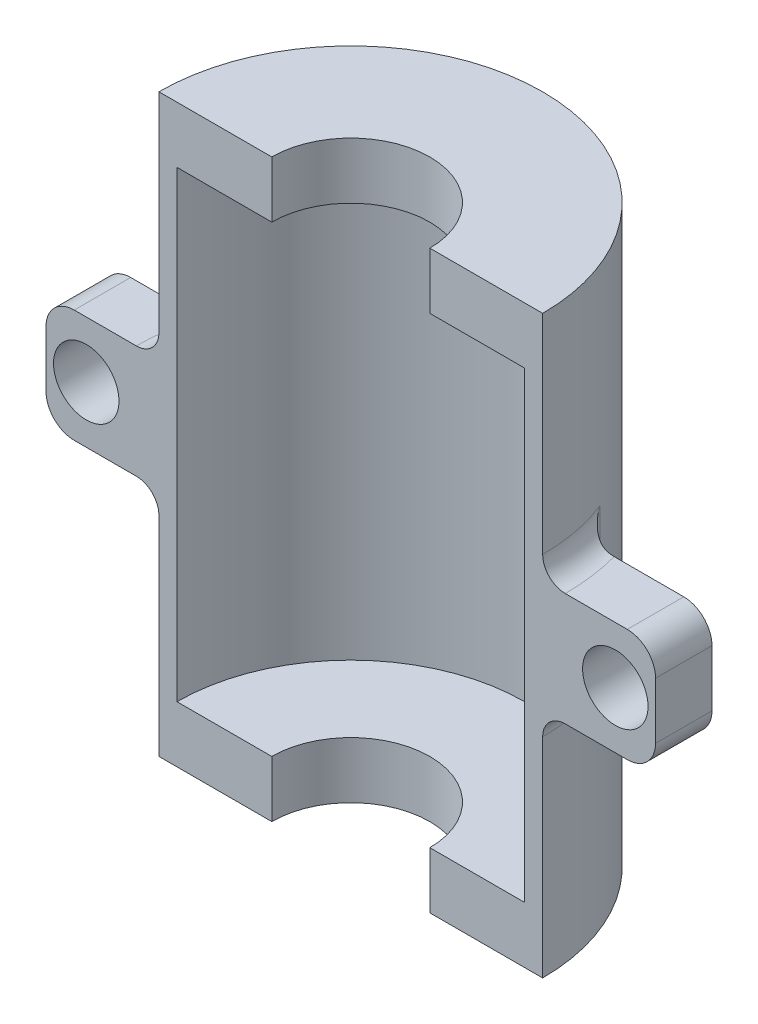
from build123d import *

# Parameters (mm, degrees)
BOSS_EXTRUDE1_DEPTH  = 20.5
BOSS_EXTRUDE2_START  = 5
BOSS_EXTRUDE2_DEPTH  = 5
BOSS_EXTRUDE3_DEPTH  = 5
FILLET1_R            = 2
SKETCH8_R            = 2.9
CUT_EXTRUDE4_DEPTH   = 5
FILLET1_OF_MIRROR3_R = 2
FILLET2_R            = 2.5


with BuildPart() as part:
    # Sketch1 → Boss-Extrude1 (new, symmetric)
    with BuildSketch(Plane(origin=(0, 0, 0), x_dir=(1, 0, 0), z_dir=(0, 1, 0))):
        with BuildLine():
            Line((-15.4, 0), (-17, 0))
            ThreePointArc((-17, 0), (0, 17), (17, 0))
            Line((17, 0), (15.4, 0))
            ThreePointArc((15.4, 0), (0, 15.4), (-15.4, 0))
        make_face()
    extrude(amount=BOSS_EXTRUDE1_DEPTH, both=True)

    # Sketch6 → Boss-Extrude2 (add)
    with BuildSketch(Plane(origin=(0, 20.5, 0), x_dir=(1, 0, 0), z_dir=(0, 1, 0)).offset(BOSS_EXTRUDE2_START)):
        with BuildLine():
            Line((-17, 0), (-7, 0))
            ThreePointArc((-7, 0), (0, 7), (7, 0))
            Line((7, 0), (17, 0))
            ThreePointArc((17, 0), (0, 17), (-17, 0))
        make_face()
    boss_extrude2 = extrude(amount=-BOSS_EXTRUDE2_DEPTH)

    # Mirror1: Boss-Extrude2 across plane
    add(boss_extrude2.mirror(Plane.ZX))

    # Sketch7 → Boss-Extrude3 (add, symmetric)
    with BuildSketch(Plane(origin=(0, 0, 0), x_dir=(1, 0, 0), z_dir=(0, 1, 0))):
        with BuildLine():
            Line((-17, 0), (-27, 0))
            Line((-27, 0), (-27, 5))
            Line((-27, 5), (-16.248076809, 5))
            ThreePointArc((-16.248076809, 5), (-16.810968231, 2.528111374), (-17, 0))
        make_face()
    boss_extrude3 = extrude(amount=BOSS_EXTRUDE3_DEPTH, both=True)

    # Fillet1
    fillet1_edges = [part.edges().sort_by_distance(p)[0] for p in [
        (-16.810968231, -5, -2.528111374),
        (-16.248076809, 0, -5),
        (-16.810968231, 5, -2.528111374),
    ]]
    fillet(fillet1_edges, radius=FILLET1_R)

    # Sketch8 → Cut-Extrude4 (cut, symmetric)
    with BuildSketch(Plane(origin=(0, 0, -5), x_dir=(-1, 0, 0), z_dir=(0, 0, -1))):
        with Locations((23.436686237, 0)):
            Circle(SKETCH8_R)
    cut_extrude4 = extrude(amount=CUT_EXTRUDE4_DEPTH, both=True, mode=Mode.SUBTRACT)

    # Mirror3: Boss-Extrude3, Cut-Extrude4 across plane
    add(boss_extrude3.mirror(Plane(origin=(0, 0, 0), x_dir=(0, 0, 1), z_dir=(1, 0, 0))))
    add(cut_extrude4.mirror(Plane(origin=(0, 0, 0), x_dir=(0, 0, 1), z_dir=(1, 0, 0))), mode=Mode.SUBTRACT)

    # Fillet1 of Mirror3
    fillet1_of_mirror3_edges = [part.edges().sort_by_distance(p)[0] for p in [
        (16.810968231, -5, -2.528111374),
        (16.248076809, 0, -5),
        (16.810968231, 5, -2.528111374),
    ]]
    fillet(fillet1_of_mirror3_edges, radius=FILLET1_OF_MIRROR3_R)

    # Fillet2
    fillet2_edges = [part.edges().sort_by_distance(p)[0] for p in [
        (-27, -5, -2.5),
        (-27, 5, -2.5),
        (27, 5, -2.5),
        (27, -5, -2.5),
    ]]
    fillet(fillet2_edges, radius=FILLET2_R)


solid = part.part
